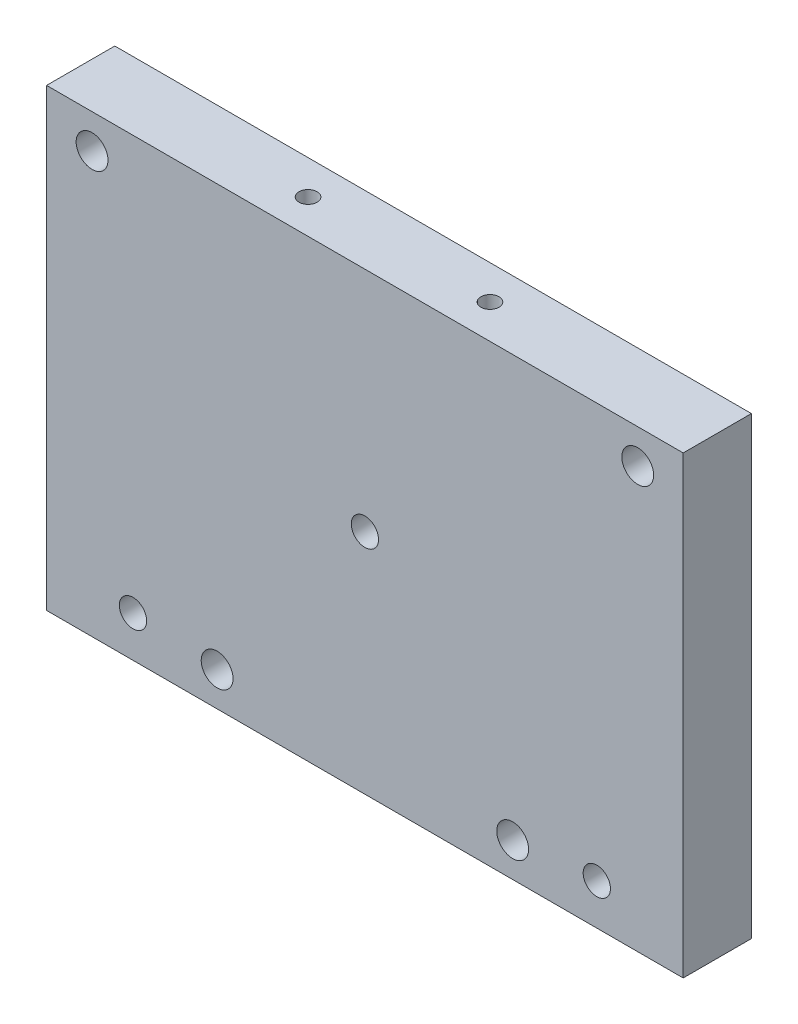
from build123d import *

# Parameters (mm, degrees)
SKETCH1_W           = 280
SKETCH1_H           = 200
SKETCH1_R           = 5
SKETCH1_R_2         = 6
BOSS_EXTRUDE1_DEPTH = 30
SKETCH2_R           = 7
CUT_EXTRUDE1_DEPTH  = 30
BOSS_EXTRUDE3_START = -10
SKETCH3_R           = 5
BOSS_EXTRUDE3_DEPTH = 10
SKETCH4_R           = 6
CUT_EXTRUDE2_DEPTH  = 30
SKETCH5_R           = 4
CUT_EXTRUDE3_DEPTH  = 200
SKETCH6_R           = 2.108291455
SKETCH6_R_2         = 2.313215084
CUT_EXTRUDE7_DEPTH  = 0.6


with BuildPart() as part:
    # Sketch1 → Boss-Extrude1 (new body)
    with BuildSketch(Plane.XY):
        Rectangle(SKETCH1_W, SKETCH1_H)
        with Locations((-120, -85)):
            Circle(SKETCH1_R, mode=Mode.SUBTRACT)
        with Locations((120, -85)):
            Circle(SKETCH1_R, mode=Mode.SUBTRACT)
        with Locations((-65, -85)):
            Circle(SKETCH1_R, mode=Mode.SUBTRACT)
        with Locations((65, -85)):
            Circle(SKETCH1_R, mode=Mode.SUBTRACT)
        with Locations((65, 85)):
            Circle(SKETCH1_R, mode=Mode.SUBTRACT)
        with Locations((-65, 85)):
            Circle(SKETCH1_R, mode=Mode.SUBTRACT)
        with Locations((-120, 85)):
            Circle(SKETCH1_R, mode=Mode.SUBTRACT)
        with Locations((120, 85)):
            Circle(SKETCH1_R, mode=Mode.SUBTRACT)
        Circle(SKETCH1_R_2, mode=Mode.SUBTRACT)
    extrude(amount=BOSS_EXTRUDE1_DEPTH)

    # Sketch2 → Cut-Extrude1 (cut)
    with BuildSketch(Plane(origin=(0, 0, 0), x_dir=(-1, 0, 0), z_dir=(0, 0, -1))):
        with Locations((-120, 85)):
            Circle(SKETCH2_R)
        with Locations((120, 85)):
            Circle(SKETCH2_R)
        with Locations((65, -85)):
            Circle(SKETCH2_R)
        with Locations((-65, -85)):
            Circle(SKETCH2_R)
    extrude(amount=-CUT_EXTRUDE1_DEPTH, mode=Mode.SUBTRACT)

    # Sketch3 → Boss-Extrude3 (add)
    with BuildSketch(Plane.XY.offset(30).offset(BOSS_EXTRUDE3_START)):
        with Locations((-120, -85)):
            Circle(SKETCH3_R)
        with Locations((120, -85)):
            Circle(SKETCH3_R)
        with Locations((-65, 85)):
            Circle(SKETCH3_R)
        with Locations((65, 85)):
            Circle(SKETCH3_R)
    extrude(amount=BOSS_EXTRUDE3_DEPTH)

    # Sketch4 → Cut-Extrude2 (cut)
    with BuildSketch(Plane.XY.offset(30)):
        with Locations((-102, -82)):
            Circle(SKETCH4_R)
        with Locations(Location((102, -82, 0), (0, 0, 180))):
            Circle(SKETCH4_R)
    extrude(amount=-CUT_EXTRUDE2_DEPTH, mode=Mode.SUBTRACT)

    # Sketch5 → Cut-Extrude3 (cut)
    with BuildSketch(Plane(origin=(0, -100, 0), x_dir=(-1, 0, 0), z_dir=(0, -1, 0))):
        with Locations(Location((40, -15, 0), (0, 0, 180))):
            Circle(SKETCH5_R)
        with Locations((-40, -15)):
            Circle(SKETCH5_R)
    extrude(amount=-CUT_EXTRUDE3_DEPTH, mode=Mode.SUBTRACT)

    # Sketch6 → Cut-Extrude7 (cut)
    # profile 1 of 6: a face of its own
    with BuildSketch(Plane.XY):
        with BuildLine():
            Line((-11.104324014, 17.945069254), (-10.223815884, 17.945042681))
            ThreePointArc((-10.223815884, 17.945042681), (-5.282103106, 15.803086541), (-7.097802531, 20.873760745))
            ThreePointArc((-7.097802531, 20.873760745), (-10.28034524, 23.758493076), (-7.293051975, 26.844969654))
            Line((-7.293051975, 26.844969654), (-4.090157048, 26.844872994))
            Line((-4.090157048, 26.844872994), (-4.090183621, 25.964364865))
            Line((-4.090183621, 25.964364865), (-5.174581416, 25.964397591))
            ThreePointArc((-5.174581416, 25.964397591), (-4.318518193, 23.565420803), (-5.622908359, 21.377613643))
            ThreePointArc((-5.622908359, 21.377613643), (-5.263734666, 14.711153724), (-11.104324014, 17.945069254))
        make_face()
        with Locations((-7.293142173, 23.85617007)):
            Circle(SKETCH6_R, mode=Mode.SUBTRACT)
    # profile 2 of 6: a face of its own
    with BuildSketch(Plane.XY):
        Polygon((1.840305593, 22.213875796), (2.720813722, 22.213849223), (2.720631568, 16.17802246), (1.840123439, 16.178049033), align=None)
    # profile 3 of 6: a face of its own
    with BuildSketch(Plane.XY):
        Polygon((-1.577208157, 16.178152164), (-0.696700027, 16.178125591), (-0.696381672, 26.727084122), (-1.576889802, 26.727110694), align=None)
    # profile 4 of 6: a face of its own
    with BuildSketch(Plane.XY):
        with BuildLine():
            Line((9.865957526, 20.914655791), (9.865984634, 21.812912632))
            Line((9.865984634, 21.812912632), (10.746492764, 21.81288606))
            Line((10.746492764, 21.81288606), (10.599564257, 15.942836291))
            Line((10.599564257, 15.942836291), (9.865807483, 15.942858434))
            Line((9.865807483, 15.942858434), (9.865834591, 16.841115276))
            ThreePointArc((9.865834591, 16.841115276), (4.212206408, 18.878056155), (9.865957526, 20.914655791))
        make_face()
        with Locations((7.40592962, 18.877959772)):
            Circle(SKETCH6_R_2, mode=Mode.SUBTRACT)
    # profile 5 of 6: a face of its own
    with BuildSketch(Plane.XY):
        Polygon((1.84041394, 25.804070666), (1.840441794, 26.727007563), (10.746641058, 26.726738785), (10.746613205, 25.803801888), align=None)
    # profile 6 of 6: a face of its own
    with BuildSketch(Plane.XY):
        Polygon((1.840341861, 23.415664961), (10.746541125, 23.415396183), (10.746567668, 24.294913294), (1.840368404, 24.295182072), align=None)
    extrude(amount=CUT_EXTRUDE7_DEPTH, mode=Mode.SUBTRACT)


solid = part.part
